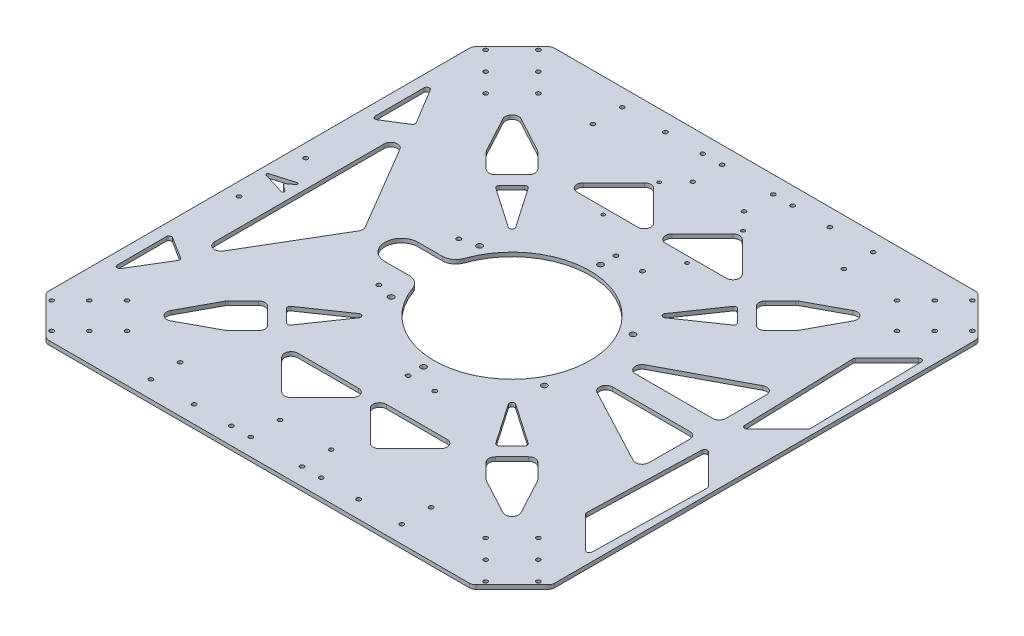
from build123d import *

# Parameters (mm, degrees)
SKETCH_1_R           = 58.5
EXTRUDE_1_DEPTH      = 3
SKETCH_3_R           = 1.55
CUT_EXTRUDE_2_DEPTH  = 269.717323595
CUT_EXTRUDE_4_DEPTH  = 269.717323595
FILLET_1_R           = 1
SKETCH_7_R           = 1.55
CUT_EXTRUDE_5_DEPTH  = 269.717323595
SKETCH_8_R           = 1.55
CUT_EXTRUDE_6_DEPTH  = 269.717323595
SKETCH_9_R           = 2.1
CUT_EXTRUDE_7_DEPTH  = 269.717323595
FILLET_2_R           = 10
SKETCH_10_R          = 1.3
CUT_EXTRUDE_8_DEPTH  = 269.717323595
SKETCH_11_R          = 1.6
CUT_EXTRUDE_9_DEPTH  = 269.717323595
SKETCH_12_R          = 1.6
CUT_EXTRUDE_10_DEPTH = 269.717323595
FILLET_3_R           = 5
CUT_EXTRUDE_11_DEPTH = 269.717323595
CUT_EXTRUDE_12_DEPTH = 269.717323595
CUT_EXTRUDE_13_DEPTH = 269.717323595
FILLET_4_R           = 2
CUT_EXTRUDE_14_DEPTH = 269.717323595
FILLET_5_R           = 2


with BuildPart() as part:
    # 草图1 → 凸台-拉伸1 (new body)
    with BuildSketch(Plane(origin=(0, 0, 0), x_dir=(1, 0, 0), z_dir=(0, 1, 0))):
        Polygon((-190, 160), (-160, 190), (160, 190), (190, 160), (190, -160), (160, -190), (-160, -190), (-190, -160), align=None)
        with Locations(Location((0, 0, 0), (0, 0, 270))):
            Circle(SKETCH_1_R, mode=Mode.SUBTRACT)
    extrude(amount=EXTRUDE_1_DEPTH)

    # 草图3 → 切除-拉伸2 (cut, through all)
    with BuildSketch(Plane(origin=(0, 3, 0), x_dir=(1, 0, 0), z_dir=(0, 1, 0))):
        with Locations(Location((-162.97918472, -182.778174593, 0), (0, 0, 270))):
            Circle(SKETCH_3_R)
        with Locations(Location((-182.778174593, -162.97918472, 0), (0, 0, 90))):
            Circle(SKETCH_3_R)
        with Locations(Location((-148.837049096, -168.636038969, 0), (0, 0, 270))):
            Circle(SKETCH_3_R)
        with Locations(Location((-134.694913472, -154.493903346, 0), (0, 0, 270))):
            Circle(SKETCH_3_R)
        with Locations(Location((-168.636038969, -148.837049096, 0), (0, 0, 90))):
            Circle(SKETCH_3_R)
        with Locations(Location((-154.493903346, -134.694913472, 0), (0, 0, 90))):
            Circle(SKETCH_3_R)
        with Locations(Location((-162.97918472, 182.778174593, 0), (0, 0, 90))):
            Circle(SKETCH_3_R)
        with Locations(Location((-148.837049096, 168.636038969, 0), (0, 0, 90))):
            Circle(SKETCH_3_R)
        with Locations(Location((-134.694913472, 154.493903346, 0), (0, 0, 90))):
            Circle(SKETCH_3_R)
        with Locations(Location((-154.493903346, 134.694913472, 0), (0, 0, 270))):
            Circle(SKETCH_3_R)
        with Locations(Location((-168.636038969, 148.837049096, 0), (0, 0, 270))):
            Circle(SKETCH_3_R)
        with Locations(Location((-182.778174593, 162.97918472, 0), (0, 0, 270))):
            Circle(SKETCH_3_R)
        with Locations(Location((182.778174593, 162.97918472, 0), (0, 0, 90))):
            Circle(SKETCH_3_R)
        with Locations(Location((168.636038969, 148.837049096, 0), (0, 0, 90))):
            Circle(SKETCH_3_R)
        with Locations(Location((154.493903346, 134.694913472, 0), (0, 0, 90))):
            Circle(SKETCH_3_R)
        with Locations(Location((134.694913472, 154.493903346, 0), (0, 0, 270))):
            Circle(SKETCH_3_R)
        with Locations(Location((148.837049096, 168.636038969, 0), (0, 0, 270))):
            Circle(SKETCH_3_R)
        with Locations(Location((162.97918472, 182.778174593, 0), (0, 0, 270))):
            Circle(SKETCH_3_R)
        with Locations(Location((162.97918472, -182.778174593, 0), (0, 0, 90))):
            Circle(SKETCH_3_R)
        with Locations(Location((148.837049096, -168.636038969, 0), (0, 0, 90))):
            Circle(SKETCH_3_R)
        with Locations(Location((134.694913472, -154.493903346, 0), (0, 0, 90))):
            Circle(SKETCH_3_R)
        with Locations(Location((154.493903346, -134.694913472, 0), (0, 0, 270))):
            Circle(SKETCH_3_R)
        with Locations(Location((168.636038969, -148.837049096, 0), (0, 0, 270))):
            Circle(SKETCH_3_R)
        with Locations(Location((182.778174593, -162.97918472, 0), (0, 0, 270))):
            Circle(SKETCH_3_R)
    extrude(amount=-CUT_EXTRUDE_2_DEPTH, mode=Mode.SUBTRACT)

    # 草图6 → 切除-拉伸4 (cut, through all)
    with BuildSketch(Plane(origin=(0, 3, 0), x_dir=(1, 0, 0), z_dir=(0, 1, 0))):
        Polygon((-187, 0), (-162, -7.5), (-172, 0), (-162, 7.5), align=None)
    extrude(amount=-CUT_EXTRUDE_4_DEPTH, mode=Mode.SUBTRACT)

    # 圆角1
    fillet_1_edges = [part.edges().sort_by_distance(p)[0] for p in [
        (-187, 1.5, 0),
        (-162, 1.5, -7.5),
        (-172, 1.5, 0),
        (-162, 1.5, 7.5),
    ]]
    fillet(fillet_1_edges, radius=FILLET_1_R)

    # 草图7 → 切除-拉伸5 (cut, through all)
    with BuildSketch(Plane(origin=(0, 3, 0), x_dir=(1, 0, 0), z_dir=(0, 1, 0))):
        with Locations(Location((19.25, 177, 0), (0, 0, 270))):
            Circle(SKETCH_7_R)
        with Locations(Location((94.25, 177, 0), (0, 0, 270))):
            Circle(SKETCH_7_R)
        with Locations(Location((19.25, 155, 0), (0, 0, 270))):
            Circle(SKETCH_7_R)
        with Locations(Location((94.25, 155, 0), (0, 0, 270))):
            Circle(SKETCH_7_R)
        with Locations(Location((33.75, 177, 0), (0, 0, 270))):
            Circle(SKETCH_7_R)
        with Locations(Location((61.75, 177, 0), (0, 0, 270))):
            Circle(SKETCH_7_R)
        with Locations(Location((-94.25, 177, 0), (0, 0, 90))):
            Circle(SKETCH_7_R)
        with Locations(Location((-94.25, 155, 0), (0, 0, 90))):
            Circle(SKETCH_7_R)
        with Locations(Location((-61.75, 177, 0), (0, 0, 90))):
            Circle(SKETCH_7_R)
        with Locations(Location((-33.75, 177, 0), (0, 0, 90))):
            Circle(SKETCH_7_R)
        with Locations(Location((-19.25, 177, 0), (0, 0, 90))):
            Circle(SKETCH_7_R)
        with Locations(Location((-19.25, 155, 0), (0, 0, 90))):
            Circle(SKETCH_7_R)
        with Locations(Location((61.75, -177, 0), (0, 0, 90))):
            Circle(SKETCH_7_R)
        with Locations(Location((33.75, -177, 0), (0, 0, 90))):
            Circle(SKETCH_7_R)
        with Locations(Location((94.25, -155, 0), (0, 0, 90))):
            Circle(SKETCH_7_R)
        with Locations(Location((19.25, -155, 0), (0, 0, 90))):
            Circle(SKETCH_7_R)
        with Locations(Location((94.25, -177, 0), (0, 0, 90))):
            Circle(SKETCH_7_R)
        with Locations(Location((19.25, -177, 0), (0, 0, 90))):
            Circle(SKETCH_7_R)
        with Locations(Location((-19.25, -155, 0), (0, 0, 270))):
            Circle(SKETCH_7_R)
        with Locations(Location((-19.25, -177, 0), (0, 0, 270))):
            Circle(SKETCH_7_R)
        with Locations(Location((-33.75, -177, 0), (0, 0, 270))):
            Circle(SKETCH_7_R)
        with Locations(Location((-61.75, -177, 0), (0, 0, 270))):
            Circle(SKETCH_7_R)
        with Locations(Location((-94.25, -155, 0), (0, 0, 270))):
            Circle(SKETCH_7_R)
        with Locations(Location((-94.25, -177, 0), (0, 0, 270))):
            Circle(SKETCH_7_R)
    extrude(amount=-CUT_EXTRUDE_5_DEPTH, mode=Mode.SUBTRACT)

    # 草图8 → 切除-拉伸6 (cut, through all)
    with BuildSketch(Plane(origin=(0, 3, 0), x_dir=(1, 0, 0), z_dir=(0, 1, 0))):
        with Locations(Location((-180, 25, 0), (0, 0, 270))):
            Circle(SKETCH_8_R)
        with Locations(Location((-180, -25, 0), (0, 0, 90))):
            Circle(SKETCH_8_R)
    extrude(amount=-CUT_EXTRUDE_6_DEPTH, mode=Mode.SUBTRACT)

    # 草图9 → 切除-拉伸7 (cut, through all)
    with BuildSketch(Plane(origin=(0, 3, 0), x_dir=(1, 0, 0), z_dir=(0, 1, 0))):
        with Locations(Location((0, -66.5, 0), (0, 0, 270))):
            Circle(SKETCH_9_R)
        with Locations(Location((-57.590689352, -33.25, 0), (0, 0, 270))):
            Circle(SKETCH_9_R)
        with Locations(Location((-57.590689352, 33.25, 0), (0, 0, 270))):
            Circle(SKETCH_9_R)
        with Locations(Location((0, 66.5, 0), (0, 0, 270))):
            Circle(SKETCH_9_R)
        with Locations(Location((57.590689352, 33.25, 0), (0, 0, 270))):
            Circle(SKETCH_9_R)
        with Locations(Location((57.590689352, -33.25, 0), (0, 0, 270))):
            Circle(SKETCH_9_R)
        with BuildLine():
            Line((-83, -12.5), (-57.148928249, -12.5))
            ThreePointArc((-57.148928249, -12.5), (-58.5, 0), (-57.148928249, 12.5))
            Line((-57.148928249, 12.5), (-83, 12.5))
            ThreePointArc((-83, 12.5), (-95.5, 0), (-83, -12.5))
        make_face()
    extrude(amount=-CUT_EXTRUDE_7_DEPTH, mode=Mode.SUBTRACT)

    # 圆角2
    fillet_2_edges = [part.edges().sort_by_distance(p)[0] for p in [
        (-57.148928249, 1.5, -12.5),
        (-57.148928249, 1.5, 12.5),
    ]]
    fillet(fillet_2_edges, radius=FILLET_2_R)

    # 草图10 → 切除-拉伸8 (cut, through all)
    with BuildSketch(Plane(origin=(0, 3, 0), x_dir=(1, 0, 0), z_dir=(0, 1, 0))):
        with Locations(Location((-31.5, 142, 0), (0, 0, 270))):
            Circle(SKETCH_10_R)
        with Locations(Location((31.5, 142, 0), (0, 0, 270))):
            Circle(SKETCH_10_R)
        with Locations(Location((31.5, 100, 0), (0, 0, 270))):
            Circle(SKETCH_10_R)
        with Locations(Location((-31.5, 100, 0), (0, 0, 270))):
            Circle(SKETCH_10_R)
    extrude(amount=-CUT_EXTRUDE_8_DEPTH, mode=Mode.SUBTRACT)

    # 草图11 → 切除-拉伸9 (cut, through all)
    with BuildSketch(Plane.XZ):
        with Locations(Location((-70, -30, 0), (0, 0, 270))):
            Circle(SKETCH_11_R)
        with Locations(Location((-70, 30, 0), (0, 0, 90))):
            Circle(SKETCH_11_R)
    extrude(amount=-CUT_EXTRUDE_9_DEPTH, mode=Mode.SUBTRACT)

    # 草图12 → 切除-拉伸10 (cut, through all)
    with BuildSketch(Plane.XZ):
        with Locations(Location((20, 78, 0), (0, 0, 270))):
            Circle(SKETCH_12_R)
        with Locations(Location((0, 78, 0), (0, 0, 270))):
            Circle(SKETCH_12_R)
        with Locations(Location((0, -78, 0), (0, 0, 90))):
            Circle(SKETCH_12_R)
        with Locations(Location((20, -78, 0), (0, 0, 90))):
            Circle(SKETCH_12_R)
    extrude(amount=-CUT_EXTRUDE_10_DEPTH, mode=Mode.SUBTRACT)

    # 圆角3
    fillet_3_edges = [part.edges().sort_by_distance(p)[0] for p in [
        (160, 1.5, -190),
        (190, 1.5, -160),
        (190, 1.5, 160),
        (160, 1.5, 190),
        (-160, 1.5, 190),
        (-190, 1.5, 160),
        (-190, 1.5, -160),
        (-160, 1.5, -190),
    ]]
    fillet(fillet_3_edges, radius=FILLET_3_R)

    # 草图13 → 切除-拉伸11 (cut, through all)
    with BuildSketch(Plane(origin=(0, 3, 0), x_dir=(1, 0, 0), z_dir=(0, 1, 0))):
        with BuildLine():
            Line((-98.057107276, 117.13440242), (-124.745796966, 131.51949225))
            ThreePointArc((-124.745796966, 131.51949225), (-130.653652491, 130.653652491), (-131.51949225, 124.745796966))
            Line((-131.51949225, 124.745796966), (-117.13440242, 98.057107276))
            ThreePointArc((-117.13440242, 98.057107276), (-116.743875443, 97.443945877), (-116.268562662, 96.893894989))
            Line((-116.268562662, 96.893894989), (-104.970498102, 85.595830429))
            ThreePointArc((-104.970498102, 85.595830429), (-101.434964196, 84.131364335), (-97.89943029, 85.595830429))
            Line((-97.89943029, 85.595830429), (-85.595830429, 97.89943029))
            ThreePointArc((-85.595830429, 97.89943029), (-84.131364335, 101.434964196), (-85.595830429, 104.970498102))
            Line((-85.595830429, 104.970498102), (-96.893894989, 116.268562662))
            ThreePointArc((-96.893894989, 116.268562662), (-97.443945877, 116.743875443), (-98.057107276, 117.13440242))
        make_face()
        with BuildLine():
            Line((-131.51949225, -124.745796966), (-117.13440242, -98.057107276))
            ThreePointArc((-117.13440242, -98.057107276), (-116.743875443, -97.443945877), (-116.268562662, -96.893894989))
            Line((-116.268562662, -96.893894989), (-104.970498102, -85.595830429))
            ThreePointArc((-104.970498102, -85.595830429), (-101.434964196, -84.131364335), (-97.89943029, -85.595830429))
            Line((-97.89943029, -85.595830429), (-85.595830429, -97.89943029))
            ThreePointArc((-85.595830429, -97.89943029), (-84.131364335, -101.434964196), (-85.595830429, -104.970498102))
            Line((-85.595830429, -104.970498102), (-96.893894989, -116.268562662))
            ThreePointArc((-96.893894989, -116.268562662), (-97.443945877, -116.743875443), (-98.057107276, -117.13440242))
            Line((-98.057107276, -117.13440242), (-124.745796966, -131.51949225))
            ThreePointArc((-124.745796966, -131.51949225), (-130.653652491, -130.653652491), (-131.51949225, -124.745796966))
        make_face()
        with BuildLine():
            Line((117.13440242, 98.057107276), (131.51949225, 124.745796966))
            ThreePointArc((131.51949225, 124.745796966), (130.653652491, 130.653652491), (124.745796966, 131.51949225))
            Line((124.745796966, 131.51949225), (98.057107276, 117.13440242))
            ThreePointArc((98.057107276, 117.13440242), (97.443945877, 116.743875443), (96.893894989, 116.268562662))
            Line((96.893894989, 116.268562662), (85.595830429, 104.970498102))
            ThreePointArc((85.595830429, 104.970498102), (84.131364335, 101.434964196), (85.595830429, 97.89943029))
            Line((85.595830429, 97.89943029), (97.89943029, 85.595830429))
            ThreePointArc((97.89943029, 85.595830429), (101.434964196, 84.131364335), (104.970498102, 85.595830429))
            Line((104.970498102, 85.595830429), (116.268562662, 96.893894989))
            ThreePointArc((116.268562662, 96.893894989), (116.743875443, 97.443945877), (117.13440242, 98.057107276))
        make_face()
        with BuildLine():
            Line((98.057107276, -117.13440242), (124.745796966, -131.51949225))
            ThreePointArc((124.745796966, -131.51949225), (130.653652491, -130.653652491), (131.51949225, -124.745796966))
            Line((131.51949225, -124.745796966), (117.13440242, -98.057107276))
            ThreePointArc((117.13440242, -98.057107276), (116.743875443, -97.443945877), (116.268562662, -96.893894989))
            Line((116.268562662, -96.893894989), (104.970498102, -85.595830429))
            ThreePointArc((104.970498102, -85.595830429), (101.434964196, -84.131364335), (97.89943029, -85.595830429))
            Line((97.89943029, -85.595830429), (85.595830429, -97.89943029))
            ThreePointArc((85.595830429, -97.89943029), (84.131364335, -101.434964196), (85.595830429, -104.970498102))
            Line((85.595830429, -104.970498102), (96.893894989, -116.268562662))
            ThreePointArc((96.893894989, -116.268562662), (97.443945877, -116.743875443), (98.057107276, -117.13440242))
        make_face()
    extrude(amount=-CUT_EXTRUDE_11_DEPTH, mode=Mode.SUBTRACT)

    # 草图14 → 切除-拉伸12 (cut, through all)
    with BuildSketch(Plane.XZ):
        with BuildLine():
            Line((59.579545122, 113.360239326), (36.780046332, 136.159738115))
            ThreePointArc((36.780046332, 136.159738115), (33.244512426, 137.624204209), (29.70897852, 136.159738115))
            Line((29.70897852, 136.159738115), (6.90947973, 113.360239326))
            ThreePointArc((6.90947973, 113.360239326), (5.825615974, 107.911288258), (10.445013636, 104.82470542))
            Line((10.445013636, 104.82470542), (56.044011216, 104.82470542))
            ThreePointArc((56.044011216, 104.82470542), (60.663408878, 107.911288258), (59.579545122, 113.360239326))
        make_face()
        with BuildLine():
            Line((139.652561445, 48.624771157), (81.826348845, 17.952942449))
            ThreePointArc((81.826348845, 17.952942449), (79.317155148, 12.328676621), (84.169244322, 8.535834709))
            Line((84.169244322, 8.535834709), (142.151266508, 8.535834709))
            ThreePointArc((142.151266508, 8.535834709), (145.695768988, 10.009292186), (147.151201996, 13.561233843))
            Line((147.151201996, 13.561233843), (146.99539241, 44.233062551))
            ThreePointArc((146.99539241, 44.233062551), (144.561921713, 48.498730706), (139.652561445, 48.624771157))
        make_face()
        with BuildLine():
            Line((147.151201996, -13.561233843), (146.99539241, -44.233062551))
            ThreePointArc((146.99539241, -44.233062551), (144.561921713, -48.498730706), (139.652561445, -48.624771157))
            Line((139.652561445, -48.624771157), (81.826348845, -17.952942449))
            ThreePointArc((81.826348845, -17.952942449), (79.317155148, -12.328676621), (84.169244322, -8.535834709))
            Line((84.169244322, -8.535834709), (142.151266508, -8.535834709))
            ThreePointArc((142.151266508, -8.535834709), (145.695768988, -10.009292186), (147.151201996, -13.561233843))
        make_face()
        with BuildLine():
            Line((-159.740902133, 63.745967489), (-159.740902133, -63.745967489))
            ThreePointArc((-159.740902133, -63.745967489), (-156.058627582, -68.56920288), (-150.435462276, -66.288247497))
            Line((-150.435462276, -66.288247497), (-112.794685911, -2.542280009))
            ThreePointArc((-112.794685911, -2.542280009), (-112.100125768, 0), (-112.794685911, 2.542280009))
            Line((-112.794685911, 2.542280009), (-150.435462276, 66.288247497))
            ThreePointArc((-150.435462276, 66.288247497), (-156.058627582, 68.56920288), (-159.740902133, 63.745967489))
        make_face()
        Polygon((183.710631246, -128.409876788), (156.028217213, -100.727462754), (158.831499647, -11.372835177), (185.462682768, -38.004018298), align=None)
        Polygon((158.831499647, 11.372835177), (185.462682768, 38.004018298), (183.710631246, 128.409876788), (156.028217213, 100.727462754), align=None)
        with BuildLine():
            Line((29.70897852, -136.159738115), (6.90947973, -113.360239326))
            ThreePointArc((6.90947973, -113.360239326), (5.825615974, -107.911288258), (10.445013636, -104.82470542))
            Line((10.445013636, -104.82470542), (56.044011216, -104.82470542))
            ThreePointArc((56.044011216, -104.82470542), (60.663408878, -107.911288258), (59.579545122, -113.360239326))
            Line((59.579545122, -113.360239326), (36.780046332, -136.159738115))
            ThreePointArc((36.780046332, -136.159738115), (33.244512426, -137.624204209), (29.70897852, -136.159738115))
        make_face()
        with BuildLine():
            Line((-59.579545122, -113.360239326), (-36.780046332, -136.159738115))
            ThreePointArc((-36.780046332, -136.159738115), (-33.244512426, -137.624204209), (-29.70897852, -136.159738115))
            Line((-29.70897852, -136.159738115), (-6.90947973, -113.360239326))
            ThreePointArc((-6.90947973, -113.360239326), (-5.825615974, -107.911288258), (-10.445013636, -104.82470542))
            Line((-10.445013636, -104.82470542), (-56.044011216, -104.82470542))
            ThreePointArc((-56.044011216, -104.82470542), (-60.663408878, -107.911288258), (-59.579545122, -113.360239326))
        make_face()
        with BuildLine():
            Line((-29.70897852, 136.159738115), (-6.90947973, 113.360239326))
            ThreePointArc((-6.90947973, 113.360239326), (-5.825615974, 107.911288258), (-10.445013636, 104.82470542))
            Line((-10.445013636, 104.82470542), (-56.044011216, 104.82470542))
            ThreePointArc((-56.044011216, 104.82470542), (-60.663408878, 107.911288258), (-59.579545122, 113.360239326))
            Line((-59.579545122, 113.360239326), (-36.780046332, 136.159738115))
            ThreePointArc((-36.780046332, 136.159738115), (-33.244512426, 137.624204209), (-29.70897852, 136.159738115))
        make_face()
    extrude(amount=-CUT_EXTRUDE_12_DEPTH, mode=Mode.SUBTRACT)

    # 草图15 → 切除-拉伸13 (cut, through all)
    with BuildSketch(Plane.XZ):
        Polygon((-78.265545086, -91.087580009), (-91.087580009, -78.265545086), (-50.016251984, -50.016251984), align=None)
        Polygon((-91.087580009, 78.265545086), (-78.265545086, 91.087580009), (-50.016251984, 50.016251984), align=None)
        Polygon((78.265545086, 91.087580009), (91.087580009, 78.265545086), (50.016251984, 50.016251984), align=None)
        Polygon((91.087580009, -78.265545086), (78.265545086, -91.087580009), (50.016251984, -50.016251984), align=None)
    extrude(amount=-CUT_EXTRUDE_13_DEPTH, mode=Mode.SUBTRACT)

    # 圆角4
    fillet_4_edges = [part.edges().sort_by_distance(p)[0] for p in [
        (158.831499647, 1.5, 11.372835177),
        (156.028217213, 1.5, 100.727462754),
        (183.710631246, 1.5, 128.409876788),
        (185.462682768, 1.5, 38.004018298),
        (158.831499647, 1.5, -11.372835177),
        (185.462682768, 1.5, -38.004018298),
        (183.710631246, 1.5, -128.409876788),
        (156.028217213, 1.5, -100.727462754),
        (78.265545086, 1.5, -91.087580009),
        (50.016251984, 1.5, -50.016251984),
        (91.087580009, 1.5, -78.265545086),
        (91.087580009, 1.5, 78.265545086),
        (50.016251984, 1.5, 50.016251984),
        (78.265545086, 1.5, 91.087580009),
        (-78.265545086, 1.5, 91.087580009),
        (-50.016251984, 1.5, 50.016251984),
        (-91.087580009, 1.5, 78.265545086),
        (-91.087580009, 1.5, -78.265545086),
        (-50.016251984, 1.5, -50.016251984),
        (-78.265545086, 1.5, -91.087580009),
    ]]
    fillet(fillet_4_edges, radius=FILLET_4_R)

    # 草图16 → 切除-拉伸14 (cut, through all)
    with BuildSketch(Plane.XZ):
        Polygon((-181.251425119, -122.389727271), (-181.251425119, -74.804464642), (-160.454902933, -87.846351436), align=None)
        Polygon((-181.251425119, 74.804464642), (-160.454902933, 87.846351436), (-181.251425119, 122.389727271), align=None)
    extrude(amount=-CUT_EXTRUDE_14_DEPTH, mode=Mode.SUBTRACT)

    # 圆角5
    fillet_5_edges = [part.edges().sort_by_distance(p)[0] for p in [
        (-160.454902933, 1.5, -87.846351436),
        (-181.251425119, 1.5, -122.389727271),
        (-181.251425119, 1.5, -74.804464642),
        (-181.251425119, 1.5, 74.804464642),
        (-181.251425119, 1.5, 122.389727271),
        (-160.454902933, 1.5, 87.846351436),
    ]]
    fillet(fillet_5_edges, radius=FILLET_5_R)


solid = part.part
